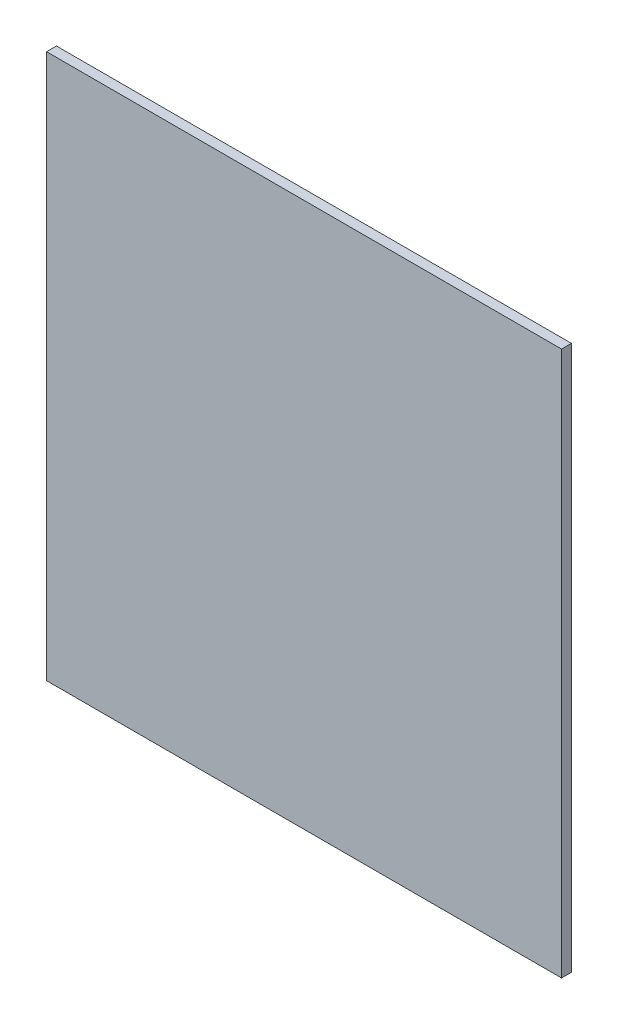
from build123d import *

# Parameters (mm, degrees)
ESQUISSE1_W        = 312
ESQUISSE1_H        = 330
BOSS_EXTRU_1_DEPTH = 6


with BuildPart() as part:
    # Esquisse1 → Boss.-Extru.1 (new body)
    with BuildSketch(Plane.XY):
        with Locations((-156, 165)):
            Rectangle(ESQUISSE1_W, ESQUISSE1_H)
    extrude(amount=BOSS_EXTRU_1_DEPTH)


solid = part.part
